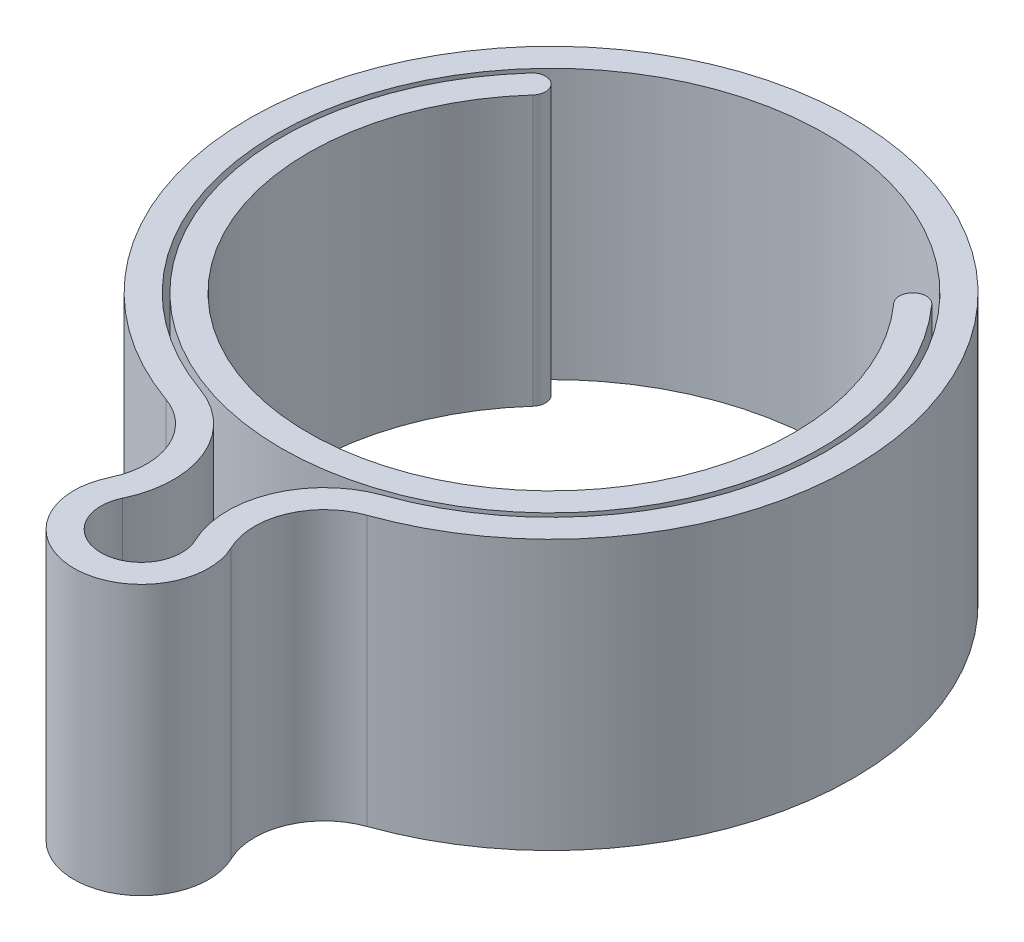
from build123d import *

# Parameters (mm, degrees)
EXTRUDE_1_DEPTH   = 5
EXTRUDE_1_2_DEPTH = 5


with BuildPart() as part:
    # Эскиз1 → Бобышка-Вытянуть1 (new body)
    with BuildSketch(Plane(origin=(0, 0, 0), x_dir=(1, 0, 0), z_dir=(0, 1, 0))):
        with BuildLine():
            ThreePointArc((-3.716714381, 3.344552917), (0, -5), (3.716714381, 3.344552917))
            ThreePointArc((3.716714381, 3.344552917), (3.363651016, 3.36316099), (3.345042943, 3.010097625))
            ThreePointArc((3.345042943, 3.010097625), (0, -4.5), (-3.345042943, 3.010097625))
            ThreePointArc((-3.345042943, 3.010097625), (-3.363651016, 3.36316099), (-3.716714381, 3.344552917))
        make_face()
    extrude(amount=EXTRUDE_1_DEPTH)


with BuildPart() as body_2:
    # Эскиз1 → Extrude 1 2 (new body)
    with BuildSketch(Plane(origin=(0, 0, 0), x_dir=(1, 0, 0), z_dir=(0, 1, 0))):
        with BuildLine():
            ThreePointArc((-1.12711488, -7.059526089), (-1.098214776, -6.006138923), (-1.86288923, -5.281064639))
            ThreePointArc((-1.86288923, -5.281064639), (0, 5.6), (1.86288923, -5.281064639))
            ThreePointArc((1.86288923, -5.281064639), (1.098214776, -6.006138923), (1.12711488, -7.059526089))
            ThreePointArc((1.12711488, -7.059526089), (0, -8.85), (-1.12711488, -7.059526089))
        make_face()
        with BuildLine():
            ThreePointArc((-0.676268928, -7.275715654), (0, -8.35), (0.676268928, -7.275715654))
            ThreePointArc((0.676268928, -7.275715654), (0.636193444, -5.814994243), (1.696559835, -4.80954101))
            ThreePointArc((1.696559835, -4.80954101), (0, 5.1), (-1.696559835, -4.80954101))
            ThreePointArc((-1.696559835, -4.80954101), (-0.636193444, -5.814994243), (-0.676268928, -7.275715654))
        make_face(mode=Mode.SUBTRACT)
    extrude(amount=EXTRUDE_1_2_DEPTH)


solid = Compound([part.part, body_2.part])
